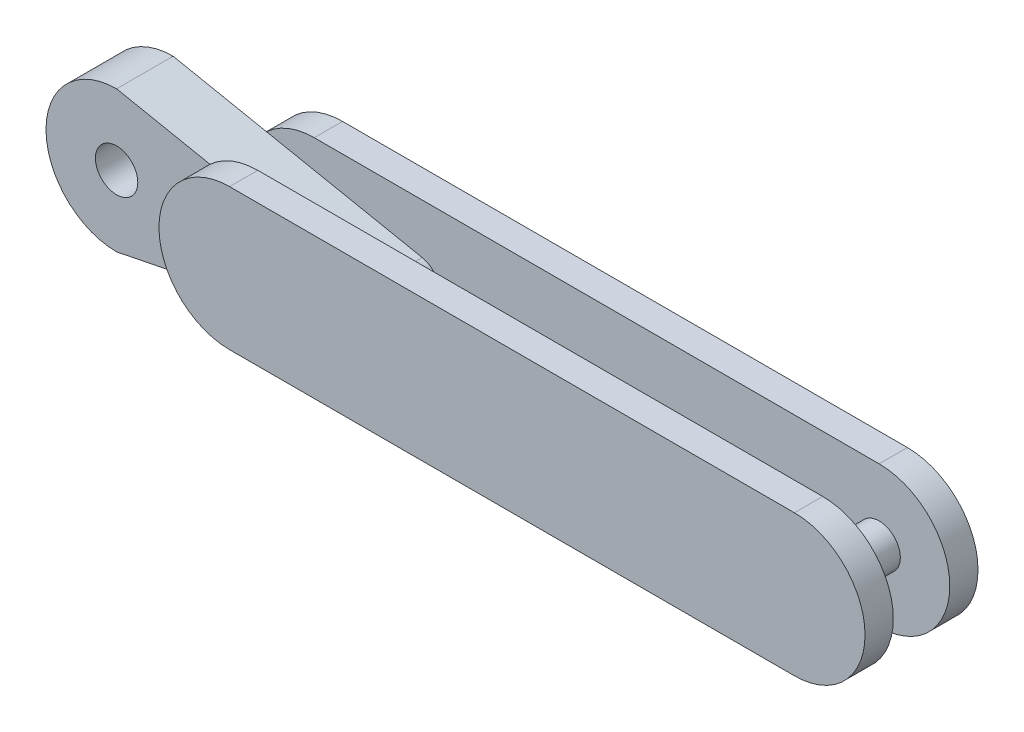
from build123d import *

# Parameters (mm, degrees)
BOSS_EXTRUDE2_DEPTH = 40
CUT_EXTRUDE2_DEPTH  = 20
CUT_EXTRUDE3_START  = -20
CUT_EXTRUDE3_DEPTH  = 20
SKETCH9_R           = 15
CUT_EXTRUDE5_DEPTH  = 40
CUT_EXTRUDE6_DEPTH  = 20
SKETCH13_R          = 15
BOSS_EXTRUDE4_DEPTH = 60
SKETCH11_R          = 15
BOSS_EXTRUDE3_DEPTH = 80


with BuildPart() as part:
    # Sketch4 → Boss-Extrude2 (new, symmetric)
    with BuildSketch(Plane.XY):
        with BuildLine():
            Line((-250, 50), (250, 50))
            ThreePointArc((250, 50), (300, 0), (250, -50))
            Line((250, -50), (-250, -50))
            ThreePointArc((-250, -50), (-300, 0), (-250, 50))
        make_face()
    extrude(amount=BOSS_EXTRUDE2_DEPTH, both=True)

    # Sketch5 → Cut-Extrude2 (cut)
    with BuildSketch(Plane.XY.offset(40)):
        with BuildLine():
            Line((-150, 50), (-250, 50))
            ThreePointArc((-250, 50), (-300, 0), (-250, -50))
            Line((-250, -50), (-150, -50))
            ThreePointArc((-150, -50), (-200, 0), (-150, 50))
        make_face()
    extrude(amount=-CUT_EXTRUDE2_DEPTH, mode=Mode.SUBTRACT)

    # Sketch6 → Cut-Extrude3 (cut)
    with BuildSketch(Plane(origin=(0, 0, -40), x_dir=(-1, 0, 0), z_dir=(0, 0, -1)).offset(CUT_EXTRUDE3_START)):
        with BuildLine():
            Line((150, 50), (250, 50))
            ThreePointArc((250, 50), (300, 0), (250, -50))
            Line((250, -50), (150, -50))
            ThreePointArc((150, -50), (200, 0), (150, 50))
        make_face()
    extrude(amount=CUT_EXTRUDE3_DEPTH, mode=Mode.SUBTRACT)

    # Sketch9 → Cut-Extrude5 (cut)
    with BuildSketch(Plane.XY.offset(20)):
        with Locations((-250, 0)):
            Circle(SKETCH9_R)
    extrude(amount=-CUT_EXTRUDE5_DEPTH, mode=Mode.SUBTRACT)

    # Sketch10 → Cut-Extrude6 (cut, symmetric)
    with BuildSketch(Plane.XY):
        with BuildLine():
            Line((-250, 50), (-73.543550677, 14.708710135))
            ThreePointArc((-73.543550677, 14.708710135), (-61.485292704, 0), (-73.543550677, -14.708710135))
            Line((-73.543550677, -14.708710135), (-250, -50))
            Line((-250, -50), (250, -50))
            ThreePointArc((250, -50), (300, 0), (250, 50))
            Line((250, 50), (-250, 50))
        make_face()
    extrude(amount=CUT_EXTRUDE6_DEPTH, both=True, mode=Mode.SUBTRACT)

    # Sketch13 → Boss-Extrude4 (add)
    with BuildSketch(Plane.XY.offset(40)):
        with Locations((250, 0)):
            Circle(SKETCH13_R)
    extrude(amount=-BOSS_EXTRUDE4_DEPTH)

    # Sketch11 → Boss-Extrude3 (add)
    with BuildSketch(Plane.XY.offset(40)):
        with Locations((250, 0)):
            Circle(SKETCH11_R)
    extrude(amount=-BOSS_EXTRUDE3_DEPTH)


with BuildPart() as part_1:
    # Body-Move/Copy1: moved
    add(part.part.moved(Location((250, 0, 0))))


solid = part_1.part
